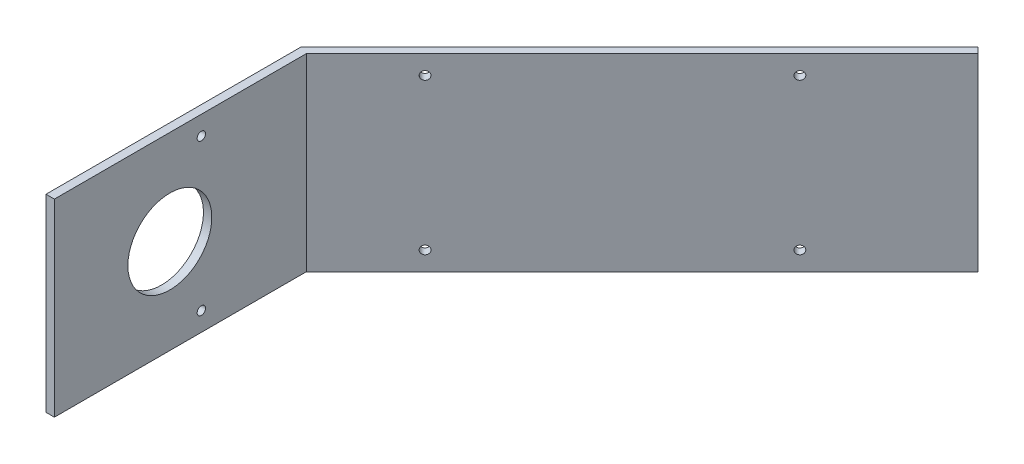
from build123d import *

# Parameters (mm, degrees)
EXTRUDE_1_DEPTH     = 45
SKETCH_3_R          = 2
CUT_EXTRUDE_2_DEPTH = 90
SKETCH_4_R          = 2
CUT_EXTRUDE_3_DEPTH = 90
SKETCH_5_R          = 20
CUT_EXTRUDE_4_DEPTH = 90


with BuildPart() as part:
    # 草图1 → 凸台-拉伸1 (new, symmetric)
    with BuildSketch(Plane(origin=(0, 0, 0), x_dir=(1, 0, 0), z_dir=(0, 1, 0))):
        Polygon((0, 0), (0, 120), (160, 280), (157.171572875, 282.828427125), (-4, 121.656854249), (-4, 0), align=None)
    extrude(amount=EXTRUDE_1_DEPTH, both=True)

    # 草图3 → 切除-拉伸2 (cut)
    with BuildSketch(Plane.ZY.offset(4)):
        with Locations((-70, -36)):
            Circle(SKETCH_3_R)
    cut_extrude_2 = extrude(amount=-CUT_EXTRUDE_2_DEPTH, mode=Mode.SUBTRACT)

    # 草图4 → 切除-拉伸3 (cut)
    with BuildSketch(Plane(origin=(-60, 0, -60), x_dir=(0.7071067811865487, 0, -0.7071067811865465), z_dir=(0.7071067811865465, 0, 0.7071067811865487))):
        with Locations((124.852813742, -36)):
            Circle(SKETCH_4_R)
        with Locations((251.126983722, -36)):
            Circle(SKETCH_4_R)
    cut_extrude_3 = extrude(amount=-CUT_EXTRUDE_3_DEPTH, mode=Mode.SUBTRACT)

    # 镜向1: 切除-拉伸2, 切除-拉伸3 across plane
    add(cut_extrude_2.mirror(Plane.ZX), mode=Mode.SUBTRACT)
    add(cut_extrude_3.mirror(Plane.ZX), mode=Mode.SUBTRACT)

    # 草图5 → 切除-拉伸4 (cut)
    with BuildSketch(Plane.ZY.offset(4)):
        with Locations((-55, 0)):
            Circle(SKETCH_5_R)
    extrude(amount=-CUT_EXTRUDE_4_DEPTH, mode=Mode.SUBTRACT)


solid = part.part
